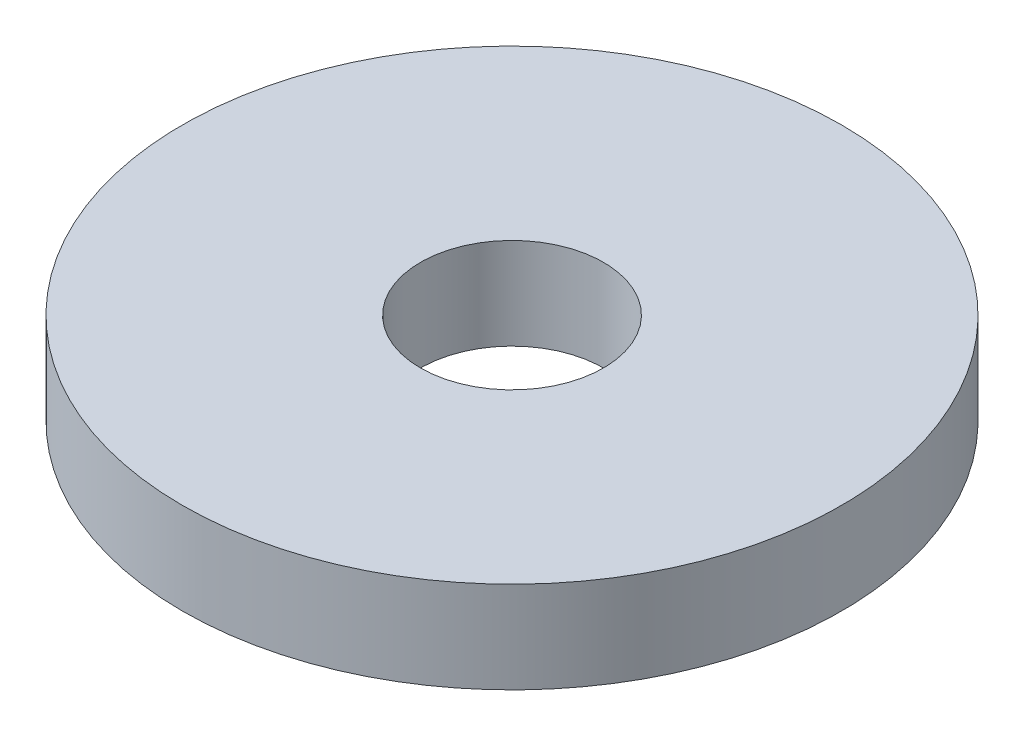
from build123d import *

# Parameters (mm, degrees)
SKETCH1_R           = 11.43
SKETCH1_R_2         = 3.175
BOSS_EXTRUDE1_DEPTH = 3.175


with BuildPart() as part:
    # Sketch1 → Boss-Extrude1 (new body)
    with BuildSketch(Plane(origin=(0, 0, 0), x_dir=(1, 0, 0), z_dir=(0, 1, 0))):
        with Locations(Location((0, 0, 0), (0, 0, 270))):
            Circle(SKETCH1_R)
        with Locations(Location((0, 0, 0), (0, 0, 270))):
            Circle(SKETCH1_R_2, mode=Mode.SUBTRACT)
    extrude(amount=BOSS_EXTRUDE1_DEPTH)


solid = part.part
